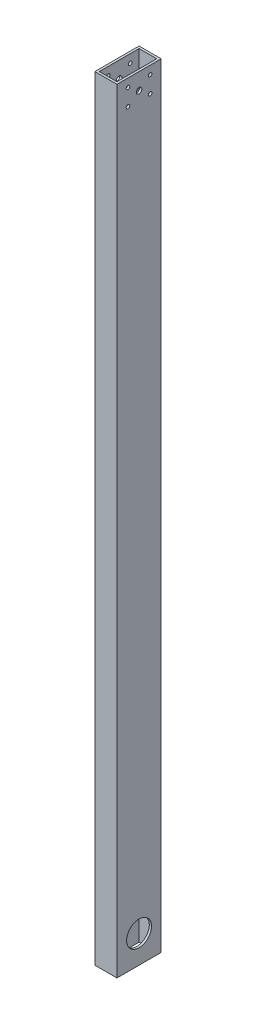
from build123d import *

# Parameters (mm, degrees)
SKETCH1_W                                 = 25.4
SKETCH1_H                                 = 50.8
SKETCH1_W_2                               = 20.32
SKETCH1_H_2                               = 45.72
VERSAFRAME_VERSAFRAME_2_X_1_X_0_1_1_DEPTH = 889
CUT_EXTRUDE1_DEPTH                        = 890.725418317
CUT_EXTRUDE1_DEPTH_BACK                   = 890.725418317
SKETCH2_R                                 = 14.2875
CUT_EXTRUDE2_DEPTH                        = 890.725418317
CUT_EXTRUDE2_DEPTH_BACK                   = 890.725418317
SKETCH3_R                                 = 2.07
SKETCH3_R_2                               = 3.175


with BuildPart() as part:
    # Sketch1 → Versaframe VERSAFRAME 2 X 1 X 0.1 (1) (new body)
    with BuildSketch(Plane(origin=(0, 0, 0), x_dir=(1, 0, 0), z_dir=(0, 1, 0))):
        Rectangle(SKETCH1_W, SKETCH1_H)
        Rectangle(SKETCH1_W_2, SKETCH1_H_2, mode=Mode.SUBTRACT)
    extrude(amount=VERSAFRAME_VERSAFRAME_2_X_1_X_0_1_1_DEPTH)

    # Sketch2 → Cut-Extrude1 (cut, two sides: drawn at the far end of the back side and taken through both)
    with BuildSketch(Plane(origin=(12.7, 0, 0), x_dir=(0, 0, -1), z_dir=(1, 0, 0)).offset(-CUT_EXTRUDE1_DEPTH_BACK)):
        with Locations((0, 31.75)):
            Circle(SKETCH2_R)
    extrude(amount=CUT_EXTRUDE1_DEPTH + CUT_EXTRUDE1_DEPTH_BACK, mode=Mode.SUBTRACT)

    # Sketch3 → Cut-Extrude2 (cut, two sides: drawn at the far end of the back side and taken through both)
    with BuildSketch(Plane(origin=(12.7, 0, 0), x_dir=(0, 0, -1), z_dir=(1, 0, 0)).offset(-CUT_EXTRUDE2_DEPTH_BACK)):
        with Locations((-12.7, 879.475)):
            Circle(SKETCH3_R)
        with Locations((-12.7, 860.425)):
            Circle(SKETCH3_R)
        with Locations((0, 869.95)):
            Circle(SKETCH3_R_2)
        with Locations((12.7, 860.425)):
            Circle(SKETCH3_R)
        with Locations((12.7, 879.475)):
            Circle(SKETCH3_R)
    extrude(amount=CUT_EXTRUDE2_DEPTH + CUT_EXTRUDE2_DEPTH_BACK, mode=Mode.SUBTRACT)


solid = part.part
